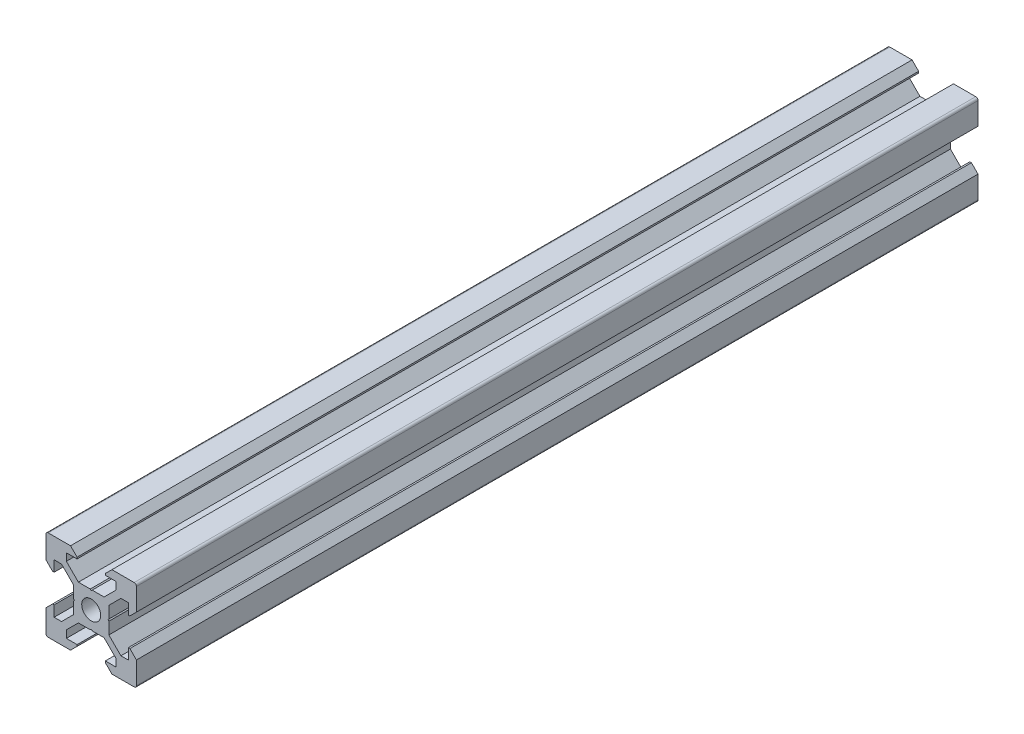
from build123d import *

# Parameters (mm, degrees)
SKETCH1_R           = 2.1
BOSS_EXTRUDE1_DEPTH = 93.05


with BuildPart() as part:
    # Sketch1 → Boss-Extrude1 (new, symmetric)
    with BuildSketch(Plane.XY):
        with BuildLine():
            Line((4.58, -10), (9.5, -10))
            ThreePointArc((9.5, -10), (9.853553391, -9.853553391), (10, -9.5))
            Line((10, -9.5), (10, -4.58))
            Line((10, -4.58), (8.545, -3.125))
            Line((8.545, -3.125), (8.2, -3.125))
            Line((8.2, -3.125), (8.2, -5.5))
            Line((8.2, -5.5), (6.560660172, -5.5))
            Line((6.560660172, -5.5), (3.9, -2.839339828))
            Line((3.9, -2.839339828), (3.9, -0.21))
            Line((3.9, -0.21), (3.69, 0))
            Line((3.69, 0), (3.9, 0.21))
            Line((3.9, 0.21), (3.9, 2.839339828))
            Line((3.9, 2.839339828), (6.560660172, 5.5))
            Line((6.560660172, 5.5), (8.2, 5.5))
            Line((8.2, 5.5), (8.2, 3.125))
            Line((8.2, 3.125), (8.545, 3.125))
            Line((8.545, 3.125), (10, 4.58))
            Line((10, 4.58), (10, 9.5))
            ThreePointArc((10, 9.5), (9.853553391, 9.853553391), (9.5, 10))
            Line((9.5, 10), (4.58, 10))
            Line((4.58, 10), (3.125, 8.545))
            Line((3.125, 8.545), (3.125, 8.2))
            Line((3.125, 8.2), (5.5, 8.2))
            Line((5.5, 8.2), (5.5, 6.560660172))
            Line((5.5, 6.560660172), (2.839339828, 3.9))
            Line((2.839339828, 3.9), (0.21, 3.9))
            Line((0.21, 3.9), (0, 3.69))
            Line((0, 3.69), (-0.21, 3.9))
            Line((-0.21, 3.9), (-2.839339828, 3.9))
            Line((-2.839339828, 3.9), (-5.5, 6.560660172))
            Line((-5.5, 6.560660172), (-5.5, 8.2))
            Line((-5.5, 8.2), (-3.125, 8.2))
            Line((-3.125, 8.2), (-3.125, 8.545))
            Line((-3.125, 8.545), (-4.58, 10))
            Line((-4.58, 10), (-9.5, 10))
            ThreePointArc((-9.5, 10), (-9.853553391, 9.853553391), (-10, 9.5))
            Line((-10, 9.5), (-10, 4.58))
            Line((-10, 4.58), (-8.545, 3.125))
            Line((-8.545, 3.125), (-8.2, 3.125))
            Line((-8.2, 3.125), (-8.2, 5.5))
            Line((-8.2, 5.5), (-6.560660172, 5.5))
            Line((-6.560660172, 5.5), (-3.9, 2.839339828))
            Line((-3.9, 2.839339828), (-3.9, 0.21))
            Line((-3.9, 0.21), (-3.69, 0))
            Line((-3.69, 0), (-3.9, -0.21))
            Line((-3.9, -0.21), (-3.9, -2.839339828))
            Line((-3.9, -2.839339828), (-6.560660172, -5.5))
            Line((-6.560660172, -5.5), (-8.2, -5.5))
            Line((-8.2, -5.5), (-8.2, -3.125))
            Line((-8.2, -3.125), (-8.545, -3.125))
            Line((-8.545, -3.125), (-10, -4.58))
            Line((-10, -4.58), (-10, -9.5))
            ThreePointArc((-10, -9.5), (-9.853553391, -9.853553391), (-9.5, -10))
            Line((-9.5, -10), (-4.58, -10))
            Line((-4.58, -10), (-3.125, -8.545))
            Line((-3.125, -8.545), (-3.125, -8.2))
            Line((-3.125, -8.2), (-5.5, -8.2))
            Line((-5.5, -8.2), (-5.5, -6.560660172))
            Line((-5.5, -6.560660172), (-2.839339828, -3.9))
            Line((-2.839339828, -3.9), (-0.21, -3.9))
            Line((-0.21, -3.9), (0, -3.69))
            Line((0, -3.69), (0.21, -3.9))
            Line((0.21, -3.9), (2.839339828, -3.9))
            Line((2.839339828, -3.9), (5.5, -6.560660172))
            Line((5.5, -6.560660172), (5.5, -8.2))
            Line((5.5, -8.2), (3.125, -8.2))
            Line((3.125, -8.2), (3.125, -8.545))
            Line((3.125, -8.545), (4.58, -10))
        make_face()
        Circle(SKETCH1_R, mode=Mode.SUBTRACT)
    extrude(amount=BOSS_EXTRUDE1_DEPTH, both=True)


solid = part.part
